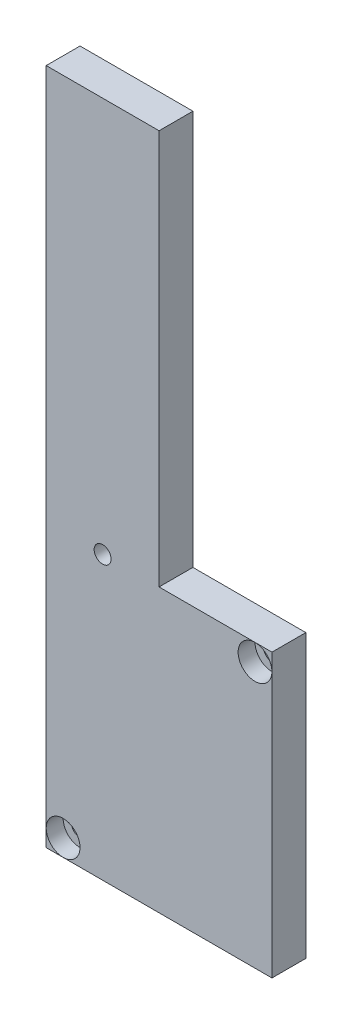
from build123d import *

# Parameters (mm, degrees)
ESQUISSE1_W             = 40
ESQUISSE1_H             = 120
BOSS_EXTRU_1_DEPTH      = 6
ESQUISSE2_W             = 20
ESQUISSE2_H             = 70
ENL_V_MAT_EXTRU_1_DEPTH = 6
ESQUISSE3_R             = 1.5
ENL_V_MAT_EXTRU_2_DEPTH = 6
ESQUISSE4_R             = 2.995
ENL_V_MAT_EXTRU_3_DEPTH = 3
ESQUISSE6_R             = 1.5
ENL_V_MAT_EXTRU_4_DEPTH = 6


with BuildPart() as part:
    # Esquisse1 → Boss.-Extru.1 (new body)
    with BuildSketch(Plane.XY):
        with Locations((20, 60)):
            Rectangle(ESQUISSE1_W, ESQUISSE1_H)
    extrude(amount=BOSS_EXTRU_1_DEPTH)

    # Esquisse2 → Enlèv. mat.-Extru.1 (cut)
    with BuildSketch(Plane.XY.offset(6)):
        with Locations((30, 85)):
            Rectangle(ESQUISSE2_W, ESQUISSE2_H)
    extrude(amount=-ENL_V_MAT_EXTRU_1_DEPTH, mode=Mode.SUBTRACT)

    # Esquisse3 → Enlèv. mat.-Extru.2 (cut)
    with BuildSketch(Plane.XY.offset(6)):
        with Locations((3, 3)):
            Circle(ESQUISSE3_R)
        with Locations((37, 47)):
            Circle(ESQUISSE3_R)
    extrude(amount=-ENL_V_MAT_EXTRU_2_DEPTH, mode=Mode.SUBTRACT)

    # Esquisse4 → Enlèv. mat.-Extru.3 (cut)
    with BuildSketch(Plane.XY.offset(6)):
        with Locations((3, 3)):
            Circle(ESQUISSE4_R)
        with Locations((37, 47)):
            Circle(ESQUISSE4_R)
    extrude(amount=-ENL_V_MAT_EXTRU_3_DEPTH, mode=Mode.SUBTRACT)

    # Esquisse6 → Enlèv. mat.-Extru.4 (cut)
    with BuildSketch(Plane.XY.offset(6)):
        with Locations((10, 50)):
            Circle(ESQUISSE6_R)
    extrude(amount=-ENL_V_MAT_EXTRU_4_DEPTH, mode=Mode.SUBTRACT)


solid = part.part
